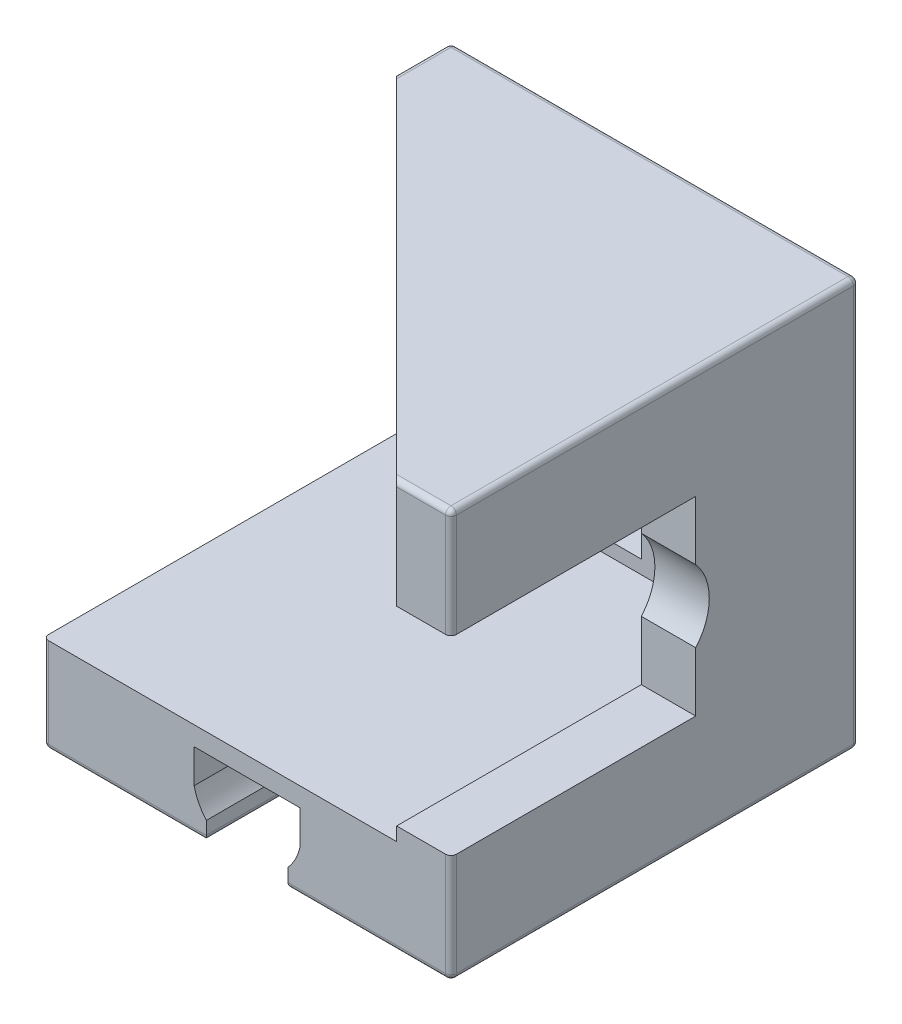
from build123d import *

# Parameters (mm, degrees)
SKETCH_1_W                      = 15
SKETCH_1_H                      = 15
EXTRUDE_1_DEPTH                 = 15
SKETCH_2_W                      = 13
SKETCH_2_H                      = 9.5
CUT_EXTRUDE_1_DEPTH             = 13
CUT_EXTRUDE_2_DEPTH             = 9.45
EXTRUDE_START                   = -4.5
EXTRUDE_2_DEPTH                 = 6
SKETCH_5_W                      = 3
SKETCH_5_H                      = 3
EXTRUDE_3_DEPTH                 = 1
CUT_EXTRUDE_3_REACH             = 26.238
CUT_EXTRUDE_4_REACH             = 29.5
CUT_EXTRUDE_5_REACH             = 26.238
CUT_EXTRUDE_5_DIRECTION_2_REACH = 26.238
SKETCH_10_W                     = 5.767295788
SKETCH_10_H                     = 2.858107371
CUT_EXTRUDE_7_DEPTH             = 25.238399287
CUT_EXTRUDE_8_DEPTH             = 2
FILLET_2_R                      = 0.2
CUT_EXTRUDE_9_REACH             = 26.88
SKETCH_12_W                     = 9
SKETCH_12_H                     = 7
CUT_EXTRUDE_10_REACH            = 23.219
SKETCH_13_W                     = 9
SKETCH_13_H                     = 7


with BuildPart() as part:
    # 草图1 → 凸台-拉伸1 (new body)
    with BuildSketch(Plane.XY):
        with Locations((0, 7.5)):
            Rectangle(SKETCH_1_W, SKETCH_1_H)
    extrude(amount=-EXTRUDE_1_DEPTH)

    # 草图2 → 切除-拉伸1 (cut)
    with BuildSketch(Plane.ZY.offset(7.5)):
        with Locations((-6.5, 8.25)):
            Rectangle(SKETCH_2_W, SKETCH_2_H)
    extrude(amount=-CUT_EXTRUDE_1_DEPTH, mode=Mode.SUBTRACT)

    # 草图3 → 切除-拉伸2 (cut)
    with BuildSketch(Plane.XY):
        with BuildLine():
            Line((-1.5, 0), (-1.5, 0.677124344))
            ThreePointArc((-1.5, 0.677124344), (-1.780042303, 1.088161527), (-1.95, 1.555590279))
            Line((-1.95, 1.555590279), (-1.95, 2.8))
            Line((-1.95, 2.8), (1.95, 2.8))
            Line((1.95, 2.8), (1.95, 1.555590279))
            ThreePointArc((1.95, 1.555590279), (1.780042303, 1.088161527), (1.5, 0.677124344))
            Line((1.5, 0.677124344), (1.5, 0))
            Line((1.5, 0), (-1.5, 0))
        make_face()
    extrude(amount=-CUT_EXTRUDE_2_DEPTH, mode=Mode.SUBTRACT)



with BuildPart() as body_2:
    # 草图4 → 凸台-拉伸2 (new body)
    with BuildSketch(Plane.XY.offset(EXTRUDE_START)):
        with BuildLine():
            Line((-1.5, 15.677124344), (1.5, 15.677124344))
            ThreePointArc((1.5, 15.677124344), (1.780042303, 16.088161527), (1.95, 16.555590279))
            Line((1.95, 16.555590279), (1.95, 17.5))
            Line((1.95, 17.5), (-1.95, 17.5))
            Line((-1.95, 17.5), (-1.95, 16.555590279))
            ThreePointArc((-1.95, 16.555590279), (-1.780042303, 16.088161527), (-1.5, 15.677124344))
        make_face()
    extrude(amount=-EXTRUDE_2_DEPTH)


with BuildPart() as part_1:
    add(part.part)

    add(body_2.part)  # 凸台-拉伸3 merges body 2
    # 草图5 → 凸台-拉伸3 (add)
    with BuildSketch(Plane(origin=(0, 15, 0), x_dir=(-1, 0, 0), z_dir=(0, 1, 0))):
        with Locations((0, -7.5)):
            Rectangle(SKETCH_5_W, SKETCH_5_H)
    extrude(amount=EXTRUDE_3_DEPTH)

    # 草图6 → 切除-拉伸3 (cut, up to next)
    with BuildSketch(Plane(origin=(0, 0, -15), x_dir=(-1, 0, 0), z_dir=(0, 0, -1)), mode=Mode.PRIVATE) as cut_extrude_3_sk1:
        with BuildLine():
            Line((-1.5, 6.177124344), (-1.5, 4))
            Line((-1.5, 4), (1.5, 4))
            Line((1.5, 4), (1.5, 6.177124344))
            ThreePointArc((1.5, 6.177124344), (2, 7.5), (1.5, 8.822875656))
            Line((1.5, 8.822875656), (1.5, 11))
            Line((1.5, 11), (-1.5, 11))
            Line((-1.5, 11), (-1.5, 8.822875656))
            ThreePointArc((-1.5, 8.822875656), (-2, 7.5), (-1.5, 6.177124344))
        make_face()
    cut_extrude_3_tool1 = extrude(cut_extrude_3_sk1.sketch, amount=-CUT_EXTRUDE_3_REACH, mode=Mode.PRIVATE) & part_1.part
    add(cut_extrude_3_tool1.solids().sort_by_distance((0, 7.5, -15))[0], mode=Mode.SUBTRACT)

    # 草图7 → 切除-拉伸4 (cut, up to next)
    with BuildSketch(Plane(origin=(7.5, 0, 0), x_dir=(0, 0, -1), z_dir=(1, 0, 0)), mode=Mode.PRIVATE) as cut_extrude_4_sk1:
        with BuildLine():
            Line((6, 6.177124344), (6, 4))
            Line((6, 4), (9, 4))
            Line((9, 4), (9, 6.177124344))
            ThreePointArc((9, 6.177124344), (9.5, 7.5), (9, 8.822875656))
            Line((9, 8.822875656), (9, 11))
            Line((9, 11), (6, 11))
            Line((6, 11), (6, 8.822875656))
            ThreePointArc((6, 8.822875656), (5.5, 7.5), (6, 6.177124344))
        make_face()
    cut_extrude_4_tool1 = extrude(cut_extrude_4_sk1.sketch, amount=-CUT_EXTRUDE_4_REACH, mode=Mode.PRIVATE) & part_1.part
    add(cut_extrude_4_tool1.solids().sort_by_distance((7.5, 7.5, -7.5))[0], mode=Mode.SUBTRACT)

    # 草图8 → 切除-拉伸5 (cut, up to next)
    with BuildSketch(Plane(origin=(0, 0, 0), x_dir=(0, 0, -1), z_dir=(1, 0, 0)), mode=Mode.PRIVATE) as cut_extrude_5_sk1:
        with BuildLine():
            Line((5.55, 17.5), (5.55, 16.555590279))
            ThreePointArc((5.55, 16.555590279), (5.719957697, 16.088161527), (6, 15.677124344))
            Line((6, 15.677124344), (4.5, 15.677124344))
            Line((4.5, 15.677124344), (4.5, 17.5))
            Line((4.5, 17.5), (5.55, 17.5))
        make_face()
    cut_extrude_5_tool1 = extrude(cut_extrude_5_sk1.sketch, amount=-CUT_EXTRUDE_5_REACH, mode=Mode.PRIVATE) & part_1.part
    # 草图8 → 切除-拉伸5 (cut, up to next)
    with BuildSketch(Plane(origin=(0, 0, 0), x_dir=(0, 0, -1), z_dir=(1, 0, 0)), mode=Mode.PRIVATE) as cut_extrude_5_sk2:
        with BuildLine():
            Line((10.5, 17.5), (9.45, 17.5))
            Line((9.45, 17.5), (9.45, 16.555590279))
            ThreePointArc((9.45, 16.555590279), (9.280042303, 16.088161527), (9, 15.677124344))
            Line((9, 15.677124344), (10.5, 15.677124344))
            Line((10.5, 15.677124344), (10.5, 17.5))
        make_face()
    cut_extrude_5_tool2 = extrude(cut_extrude_5_sk2.sketch, amount=-CUT_EXTRUDE_5_REACH, mode=Mode.PRIVATE) & part_1.part
    add(cut_extrude_5_tool1.solids().sort_by_distance((0, 16.539049, -5.075076))[0], mode=Mode.SUBTRACT)
    add(cut_extrude_5_tool2.solids().sort_by_distance((0, 16.539049, -9.924924))[0], mode=Mode.SUBTRACT)

    # 草图8 → 切除-拉伸5 direction 2 (cut, up to next)
    with BuildSketch(Plane(origin=(0, 0, 0), x_dir=(0, 0, -1), z_dir=(1, 0, 0)), mode=Mode.PRIVATE) as cut_extrude_5_direction_2_sk1:
        with BuildLine():
            Line((5.55, 17.5), (5.55, 16.555590279))
            ThreePointArc((5.55, 16.555590279), (5.719957697, 16.088161527), (6, 15.677124344))
            Line((6, 15.677124344), (4.5, 15.677124344))
            Line((4.5, 15.677124344), (4.5, 17.5))
            Line((4.5, 17.5), (5.55, 17.5))
        make_face()
    cut_extrude_5_direction_2_tool1 = extrude(cut_extrude_5_direction_2_sk1.sketch, amount=CUT_EXTRUDE_5_DIRECTION_2_REACH, mode=Mode.PRIVATE) & part_1.part
    # 草图8 → 切除-拉伸5 direction 2 (cut, up to next)
    with BuildSketch(Plane(origin=(0, 0, 0), x_dir=(0, 0, -1), z_dir=(1, 0, 0)), mode=Mode.PRIVATE) as cut_extrude_5_direction_2_sk2:
        with BuildLine():
            Line((10.5, 17.5), (9.45, 17.5))
            Line((9.45, 17.5), (9.45, 16.555590279))
            ThreePointArc((9.45, 16.555590279), (9.280042303, 16.088161527), (9, 15.677124344))
            Line((9, 15.677124344), (10.5, 15.677124344))
            Line((10.5, 15.677124344), (10.5, 17.5))
        make_face()
    cut_extrude_5_direction_2_tool2 = extrude(cut_extrude_5_direction_2_sk2.sketch, amount=CUT_EXTRUDE_5_DIRECTION_2_REACH, mode=Mode.PRIVATE) & part_1.part
    add(cut_extrude_5_direction_2_tool1.solids().sort_by_distance((0, 16.539049, -5.075076))[0], mode=Mode.SUBTRACT)
    add(cut_extrude_5_direction_2_tool2.solids().sort_by_distance((0, 16.539049, -9.924924))[0], mode=Mode.SUBTRACT)

    # 草图10 → 切除-拉伸7 (cut, through all)
    with BuildSketch(Plane.XY):
        with Locations((0, 16.429053686)):
            Rectangle(SKETCH_10_W, SKETCH_10_H)
    extrude(amount=-CUT_EXTRUDE_7_DEPTH, mode=Mode.SUBTRACT)

    # 草图11 → 切除-拉伸8 (cut)
    with BuildSketch(Plane(origin=(0, 15, 0), x_dir=(-1, 0, 0), z_dir=(0, 1, 0))):
        Polygon((7.5, -13), (7.5, 0), (-5.5, 0), align=None)
    extrude(amount=-CUT_EXTRUDE_8_DEPTH, mode=Mode.SUBTRACT)

    # 圆角2
    fillet_2_edges = [part_1.edges().sort_by_distance(p)[0] for p in [
        (7.5, 7.5, -15),
        (0, 15, -15),
        (-7.5, 1.75, 0),
        (4.5, 0, 0),
        (0, 0, -9.45),
        (1.5, 0, -4.725),
        (-1.5, 0, -4.725),
        (-7.5, 7.5, -15),
        (6.5, 15, 0),
        (7.5, 7.5, 0),
        (-4.5, 0, 0),
        (0, 0, -15),
        (-7.5, 15, -14),
        (7.5, 15, -7.5),
        (7.5, 0, -7.5),
        (-7.5, 0, -7.5),
    ]]
    fillet(fillet_2_edges, radius=FILLET_2_R)

    # 草图12 → 切除-拉伸9 (cut, up to next)
    with BuildSketch(Plane.ZY.offset(-5.5), mode=Mode.PRIVATE) as cut_extrude_9_sk1:
        with Locations((-4.5, 7.5)):
            Rectangle(SKETCH_12_W, SKETCH_12_H)
    cut_extrude_9_tool1 = extrude(cut_extrude_9_sk1.sketch, amount=-CUT_EXTRUDE_9_REACH, mode=Mode.PRIVATE) & part_1.part
    add(cut_extrude_9_tool1.solids().sort_by_distance((5.5, 7.5, -4.5))[0], mode=Mode.SUBTRACT)

    # 草图13 → 切除-拉伸10 (cut, up to next)
    with BuildSketch(Plane.XY.offset(-13), mode=Mode.PRIVATE) as cut_extrude_10_sk1:
        with Locations((-3, 7.5)):
            Rectangle(SKETCH_13_W, SKETCH_13_H)
    cut_extrude_10_tool1 = extrude(cut_extrude_10_sk1.sketch, amount=-CUT_EXTRUDE_10_REACH, mode=Mode.PRIVATE) & part_1.part
    add(cut_extrude_10_tool1.solids().sort_by_distance((-3, 7.5, -13))[0], mode=Mode.SUBTRACT)


solid = part_1.part
